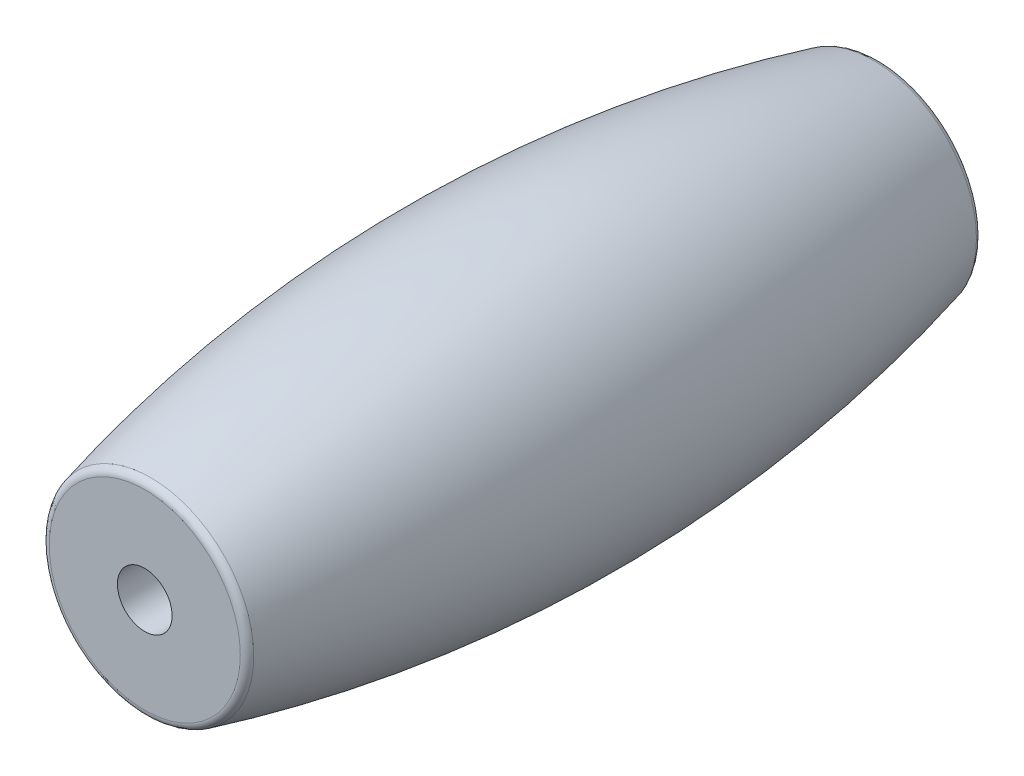
from build123d import *

# Parameters (mm, degrees)
SKETCH2_R          = 1.75
CUT_EXTRUDE1_DEPTH = 49.882512345
FILLET1_R          = 0.5


with BuildPart() as part:
    # Sketch1 → Revolve1 (revolve)
    with BuildSketch(Plane(origin=(0, 0, 0), x_dir=(1, 0, 0), z_dir=(0, 1, 0)), mode=Mode.PRIVATE) as revolve1_sk:
        with BuildLine():
            Line((0, 14.827980875), (0, -32.172019125))
            Line((0, -32.172019125), (6.5, -32.172019125))
            ThreePointArc((6.5, -32.172019125), (9.5, -8.672019125), (6.5, 14.827980875))
            Line((6.5, 14.827980875), (0, 14.827980875))
        make_face()
    revolve(revolve1_sk.sketch.rotate(Axis((0, 0, -14.827980875), (0, 0, 1)), 180), axis=Axis((0, 0, -14.827980875), (0, 0, 1)))

    # Sketch2 → Cut-Extrude1 (cut, through all)
    with BuildSketch(Plane.XY.offset(32.172019125)):
        Circle(SKETCH2_R)
    extrude(amount=-CUT_EXTRUDE1_DEPTH, mode=Mode.SUBTRACT)

    # Fillet1
    fillet1_edges = [part.edges().sort_by_distance(p)[0] for p in [
        (6.5, 0, 32.172019125),
        (6.5, 0, -14.827980875),
    ]]
    fillet(fillet1_edges, radius=FILLET1_R)


solid = part.part
